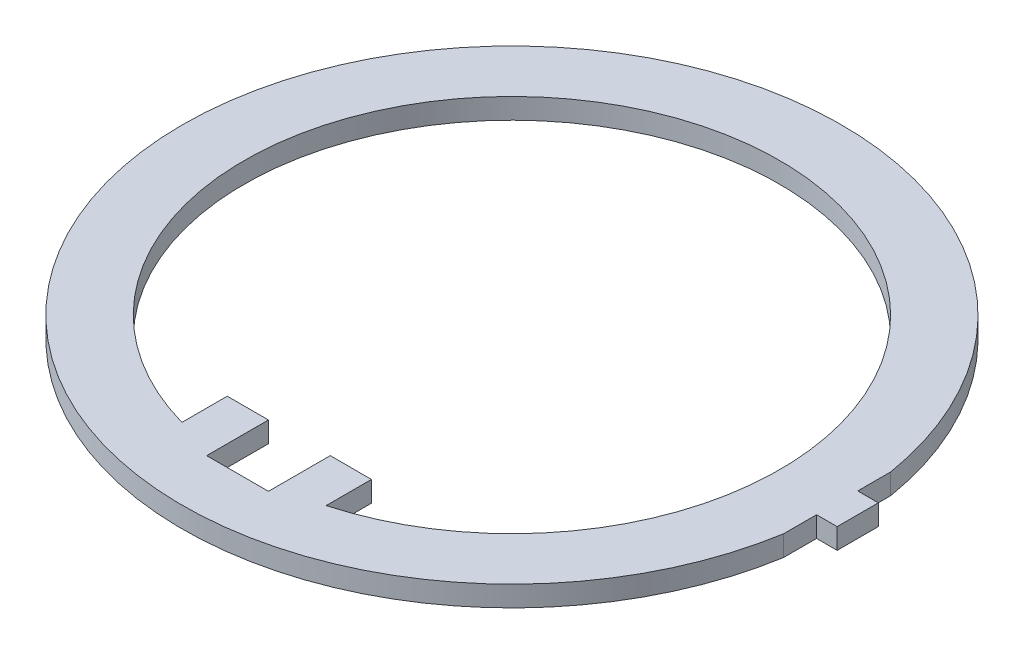
from build123d import *

# Parameters (mm, degrees)
BOSS_EXTRUDE1_DEPTH = 6.35


with BuildPart() as part:
    # Sketch1 → Boss-Extrude1 (new body)
    with BuildSketch(Plane(origin=(0, 0, 0), x_dir=(1, 0, 0), z_dir=(0, 1, 0))):
        with BuildLine():
            Line((109.774588029, 101.091898562), (109.774588029, 90.931898562))
            Line((109.774588029, 90.931898562), (116.124588029, 90.931898562))
            Line((116.124588029, 90.931898562), (116.124588029, 78.231898562))
            Line((116.124588029, 78.231898562), (109.774588029, 78.231898562))
            Line((109.774588029, 78.231898562), (109.774588029, 68.071898562))
            ThreePointArc((109.774588029, 68.071898562), (-92.075, 84.581898562), (109.774588029, 101.091898562))
        make_face()
        with BuildLine():
            Line((0, 0), (19.05, 0))
            Line((19.05, 0), (19.05, 19.05))
            Line((19.05, 19.05), (31.75, 19.05))
            Line((31.75, 19.05), (31.75, 5.08))
            ThreePointArc((31.75, 5.08), (9.525, 167.131898562), (-12.7, 5.08))
            Line((-12.7, 5.08), (-12.7, 19.05))
            Line((-12.7, 19.05), (0, 19.05))
            Line((0, 19.05), (0, 0))
        make_face(mode=Mode.SUBTRACT)
    extrude(amount=BOSS_EXTRUDE1_DEPTH)


solid = part.part
